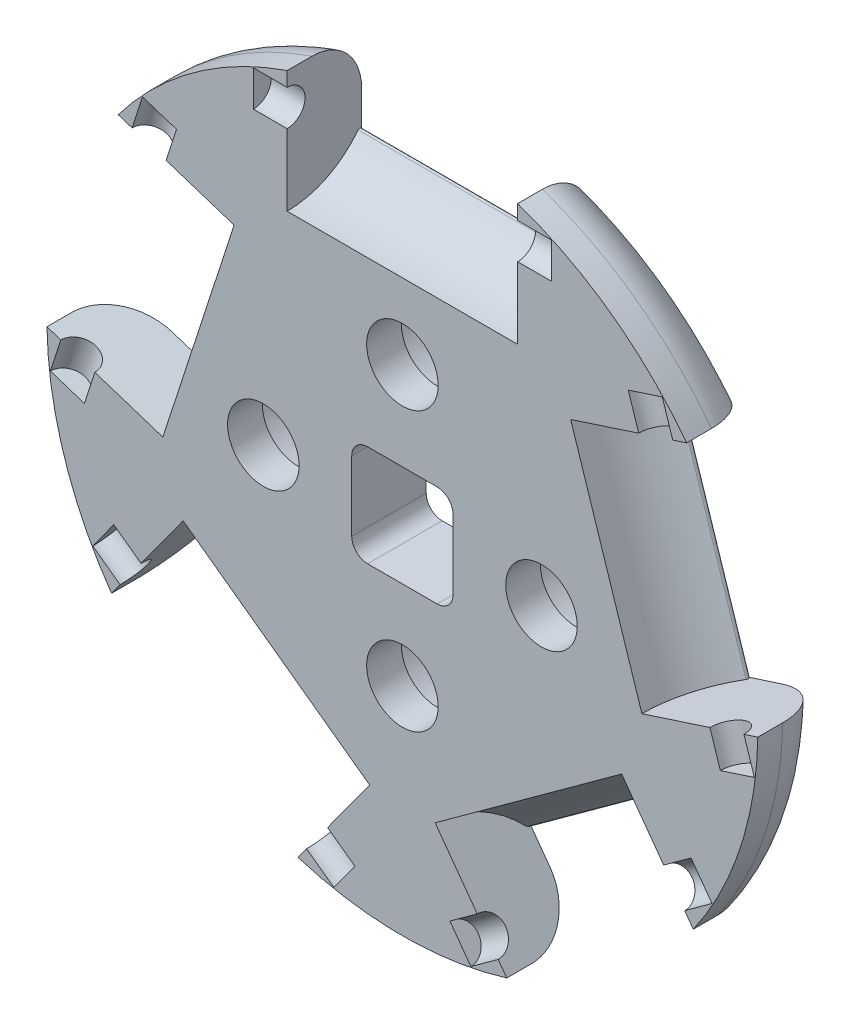
from build123d import *

# Parameters (mm, degrees)
SKETCH1_R                = 22.7203
BOSS_EXTRUDE2_DEPTH      = 4.7625
FILLET1_R                = 3.175
SKETCH2_W                = 14.732
SKETCH2_H                = 10.414
CUT_EXTRUDE2_DEPTH       = 12.7
CIRPATTERN1_COUNT        = 5
SKETCH4_R                = 1.143
CUT_EXTRUDE4_DEPTH       = 9.525
CIRPATTERN2_COUNT        = 5
SKETCH5_W                = 6.477
SKETCH5_H                = 6.477
CUT_EXTRUDE5_DEPTH       = 33.480350535
SKETCH6_R                = 2.286
CUT_EXTRUDE7_DEPTH       = 33.480350535
SKETCH7_R                = 4.445
CUT_EXTRUDE8_DEPTH       = 2.54
BOSS_EXTRUDE4_REACH      = 39.999
FILLET2_R                = 0.127
CIRPATTERN5_COUNT        = 5
FILLET2_OF_CIRPATTERN5_R = 0.127
FILLET3_R                = 1.016


with BuildPart() as part:
    # Sketch1 → Boss-Extrude2 (new body)
    with BuildSketch(Plane.XY):
        Circle(SKETCH1_R)
    extrude(amount=-BOSS_EXTRUDE2_DEPTH)

    # Fillet1
    fillet1_edges = [part.edges().sort_by_distance(p)[0] for p in [
        (-22.7203, 0, -4.7625),
    ]]
    fillet(fillet1_edges, radius=FILLET1_R)

    # Sketch2 → Cut-Extrude2 (cut)
    with BuildSketch(Plane.XY):
        with Locations((0, 18.7833)):
            Rectangle(SKETCH2_W, SKETCH2_H)
    cut_extrude2 = extrude(amount=-CUT_EXTRUDE2_DEPTH, mode=Mode.SUBTRACT)

    # CirPattern1: Cut-Extrude2 ×5 about axis
    cirpattern1_axis = Axis((0, 0, 0), (0, 0, 1))
    for i in range(1, CIRPATTERN1_COUNT):
        add(cut_extrude2.rotate(cirpattern1_axis, i * 360 / CIRPATTERN1_COUNT), mode=Mode.SUBTRACT)

    # Sketch4 → Cut-Extrude4 (cut, symmetric)
    with BuildSketch(Plane(origin=(0, 0, 0), x_dir=(0, 0, -1), z_dir=(1, 0, 0))):
        with Locations((0, 19.4183)):
            Circle(SKETCH4_R)
    cut_extrude4 = extrude(amount=CUT_EXTRUDE4_DEPTH, both=True, mode=Mode.SUBTRACT)

    # CirPattern2: Cut-Extrude4 ×5 about axis
    cirpattern2_axis = Axis((0, 0, 0), (0, 0, 1))
    for i in range(1, CIRPATTERN2_COUNT):
        add(cut_extrude4.rotate(cirpattern2_axis, i * 360 / CIRPATTERN2_COUNT), mode=Mode.SUBTRACT)

    # Sketch5 → Cut-Extrude5 (cut, through all)
    with BuildSketch(Plane.XY):
        Rectangle(SKETCH5_W, SKETCH5_H)
    extrude(amount=-CUT_EXTRUDE5_DEPTH, mode=Mode.SUBTRACT)

    # Sketch6 → Cut-Extrude7 (cut, through all)
    with BuildSketch(Plane(origin=(0, 0, -4.7625), x_dir=(-1, 0, 0), z_dir=(0, 0, -1))):
        with Locations((0, 8.89)):
            Circle(SKETCH6_R)
        with Locations((8.89, 0)):
            Circle(SKETCH6_R)
        with Locations((0, -8.89)):
            Circle(SKETCH6_R)
        with Locations((-8.89, 0)):
            Circle(SKETCH6_R)
    extrude(amount=-CUT_EXTRUDE7_DEPTH, mode=Mode.SUBTRACT)

    # Sketch7 → Cut-Extrude8 (cut)
    with BuildSketch(Plane(origin=(0, 0, -4.7625), x_dir=(-1, 0, 0), z_dir=(0, 0, -1))):
        with Locations((-8.89, 0)):
            Circle(SKETCH7_R)
        with Locations((8.89, 0)):
            Circle(SKETCH7_R)
        with Locations((0, -8.89)):
            Circle(SKETCH7_R)
        with Locations((0, 8.89)):
            Circle(SKETCH7_R)
    extrude(amount=-CUT_EXTRUDE8_DEPTH, mode=Mode.SUBTRACT)

    # Sketch10 → Boss-Extrude4 (add, up to next)
    with BuildSketch(Plane.ZY.offset(-7.366), mode=Mode.PRIVATE) as boss_extrude4_sk1:
        with BuildLine():
            Line((-4.7625, 13.5763), (0, 13.5763))
            Line((0, 13.5763), (0, 13.7033))
            ThreePointArc((0, 13.7033), (-2.7025038, 14.38265722), (-4.7625, 16.259214887))
            Line((-4.7625, 16.259214887), (-4.7625, 13.5763))
        make_face()
    boss_extrude4_tool1 = extrude(boss_extrude4_sk1.sketch, amount=BOSS_EXTRUDE4_REACH, mode=Mode.PRIVATE) - part.part
    boss_extrude4 = boss_extrude4_tool1.solids().sort_by_distance((7.366, 14.314807, -3.452063))[0]
    add(boss_extrude4)

    # Fillet2
    fillet2_edges = [part.edges().sort_by_distance(p)[0] for p in [
        (0, 16.259214887, -4.7625),
    ]]
    fillet(fillet2_edges, radius=FILLET2_R)

    # CirPattern5: Boss-Extrude4 ×5 about axis
    cirpattern5_axis = Axis((0, 0, 0), (0, 0, 1))
    for i in range(1, CIRPATTERN5_COUNT):
        add(boss_extrude4.rotate(cirpattern5_axis, i * 360 / CIRPATTERN5_COUNT))

    # Fillet2 of CirPattern5
    fillet2_of_cirpattern5_edges = [part.edges().sort_by_distance(p)[0] for p in [
        (-15.463432268, 5.024373715, -4.7625),
        (-9.556926725, -13.153981159, -4.7625),
        (9.556926725, -13.153981159, -4.7625),
        (15.463432268, 5.024373715, -4.7625),
    ]]
    fillet(fillet2_of_cirpattern5_edges, radius=FILLET2_OF_CIRPATTERN5_R)

    # Fillet3
    fillet3_edges = [part.edges().sort_by_distance(p)[0] for p in [
        (3.2385, 3.2385, -2.38125),
        (3.2385, -3.2385, -2.38125),
        (-3.2385, -3.2385, -2.38125),
        (-3.2385, 3.2385, -2.38125),
    ]]
    fillet(fillet3_edges, radius=FILLET3_R)


solid = part.part
